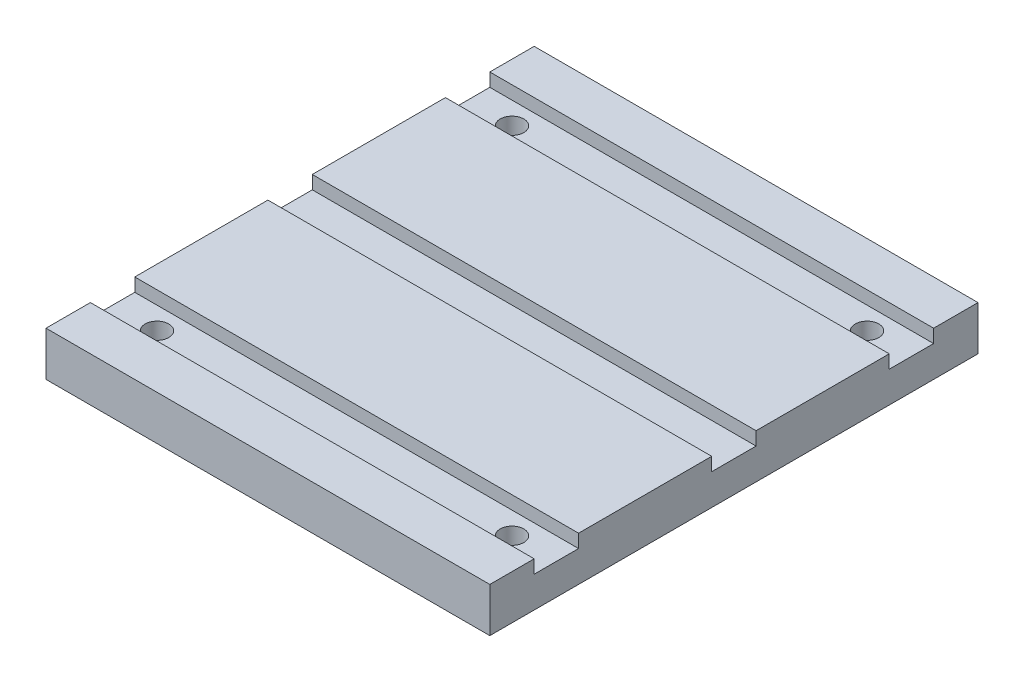
from build123d import *

# Parameters (mm, degrees)
SKETCH2_W               = 127
SKETCH2_H               = 139.7
BOSS_EXTRUDE1_DEPTH     = 12.7
SKETCH4_W               = 12.7
SKETCH4_H               = 3.81
CUT_EXTRUDE1_DEPTH      = 76.2
SKETCH5_W               = 12.7
SKETCH5_H               = 3.81
CUT_EXTRUDE2_DEPTH      = 76.2
MIRROR3_COPY_1_SKETCH_W = 12.7
MIRROR3_COPY_1_SKETCH_H = 3.81
MIRROR3_COPY_1_DEPTH    = 76.2
F_1_4_CLEARANCE_HOLE1_D = 6.7564


with BuildPart() as part:
    # Sketch2 → Boss-Extrude1 (new body)
    with BuildSketch(Plane(origin=(0, 0, 0), x_dir=(1, 0, 0), z_dir=(0, 1, 0))):
        Rectangle(SKETCH2_W, SKETCH2_H)
    extrude(amount=BOSS_EXTRUDE1_DEPTH)

    # Sketch4 → Cut-Extrude1 (cut)
    with BuildSketch(Plane(origin=(63.5, 0, 0), x_dir=(0, 0, -1), z_dir=(1, 0, 0))):
        with Locations((-50.8, 10.795)):
            Rectangle(SKETCH4_W, SKETCH4_H)
    cut_extrude1 = extrude(amount=-CUT_EXTRUDE1_DEPTH, mode=Mode.SUBTRACT)

    # Mirror1: Cut-Extrude1 across plane
    add(cut_extrude1.mirror(Plane.XY), mode=Mode.SUBTRACT)

    # Sketch5 → Cut-Extrude2 (cut)
    with BuildSketch(Plane(origin=(63.5, 0, 0), x_dir=(0, 0, -1), z_dir=(1, 0, 0))):
        with Locations((0, 10.795)):
            Rectangle(SKETCH5_W, SKETCH5_H)
    cut_extrude2 = extrude(amount=-CUT_EXTRUDE2_DEPTH, mode=Mode.SUBTRACT)

    # Mirror3: Cut-Extrude1, Cut-Extrude2 across plane
    add(cut_extrude1.mirror(Plane(origin=(0, 0, 0), x_dir=(0, 0, 1), z_dir=(1, 0, 0))), mode=Mode.SUBTRACT)
    add(cut_extrude2.mirror(Plane(origin=(0, 0, 0), x_dir=(0, 0, 1), z_dir=(1, 0, 0))), mode=Mode.SUBTRACT)

    # Mirror3 copy 1 sketch → Mirror3 copy 1 (cut)
    with BuildSketch(Plane.ZY.offset(63.5)):
        with Locations((-50.8, 10.795)):
            Rectangle(MIRROR3_COPY_1_SKETCH_W, MIRROR3_COPY_1_SKETCH_H)
    extrude(amount=-MIRROR3_COPY_1_DEPTH, mode=Mode.SUBTRACT)

    # 1/4 Clearance Hole1 (through all)
    with Locations(Plane(origin=(0, 0, 0), x_dir=(-1, 0, 0), z_dir=(0, -1, 0))):
        with Locations((-50.8, -50.8), (-50.8, 50.8), (50.8, 50.8), (50.8, -50.8)):
            Hole(F_1_4_CLEARANCE_HOLE1_D / 2)


solid = part.part
